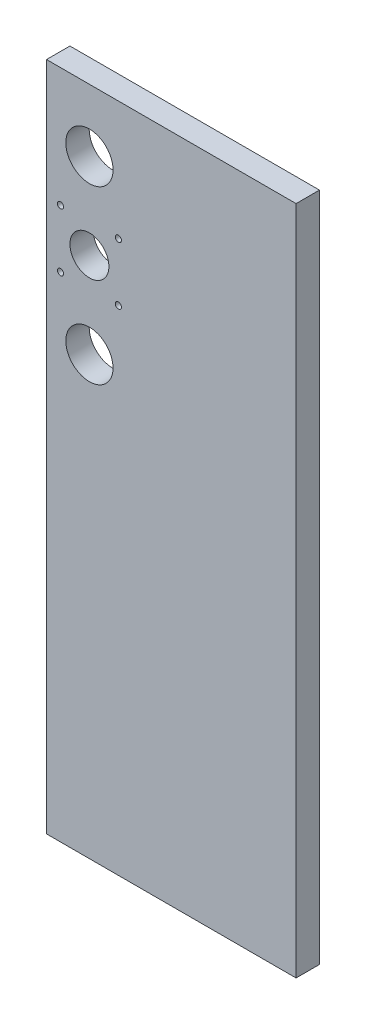
from build123d import *

# Parameters (mm, degrees)
SKETCH1_W               = 203.2
SKETCH1_H               = 546.1
BOSS_EXTRUDE1_DEPTH     = 19.05
SKETCH2_R               = 19.2405
CUT_EXTRUDE1_DEPTH      = 583.990868282
ENL_V_MAT_EXTRU_1_REACH = 584.991
ESQUISSE1_R             = 15.875
ESQUISSE1_R_2           = 2.5


with BuildPart() as part:
    # Sketch1 → Boss-Extrude1 (new body)
    with BuildSketch(Plane.XY):
        with Locations((101.6, 273.05)):
            Rectangle(SKETCH1_W, SKETCH1_H)
    extrude(amount=BOSS_EXTRUDE1_DEPTH)

    # Sketch2 → Cut-Extrude1 (cut, through all)
    with BuildSketch(Plane(origin=(0, 0, 0), x_dir=(-1, 0, 0), z_dir=(0, 0, -1))):
        with Locations((-34.925, 495.3)):
            Circle(SKETCH2_R)
        with Locations((-34.925, 355.6)):
            Circle(SKETCH2_R)
    extrude(amount=-CUT_EXTRUDE1_DEPTH, mode=Mode.SUBTRACT)

    # Esquisse1 → Enlèv. mat.-Extru.1 (cut, up to next)
    with BuildSketch(Plane(origin=(0, 0, 0), x_dir=(-1, 0, 0), z_dir=(0, 0, -1)), mode=Mode.PRIVATE) as enl_v_mat_extru_1_sk1:
        with Locations((-34.925, 425.45)):
            Circle(ESQUISSE1_R)
    enl_v_mat_extru_1_tool1 = extrude(enl_v_mat_extru_1_sk1.sketch, amount=-ENL_V_MAT_EXTRU_1_REACH, mode=Mode.PRIVATE) & part.part
    # Esquisse1 → Enlèv. mat.-Extru.1 (cut, up to next)
    with BuildSketch(Plane(origin=(0, 0, 0), x_dir=(-1, 0, 0), z_dir=(0, 0, -1)), mode=Mode.PRIVATE) as enl_v_mat_extru_1_sk2:
        with Locations((-58.4962, 449.0212)):
            Circle(ESQUISSE1_R_2)
    enl_v_mat_extru_1_tool2 = extrude(enl_v_mat_extru_1_sk2.sketch, amount=-ENL_V_MAT_EXTRU_1_REACH, mode=Mode.PRIVATE) & part.part
    # Esquisse1 → Enlèv. mat.-Extru.1 (cut, up to next)
    with BuildSketch(Plane(origin=(0, 0, 0), x_dir=(-1, 0, 0), z_dir=(0, 0, -1)), mode=Mode.PRIVATE) as enl_v_mat_extru_1_sk3:
        with Locations((-11.3538, 449.0212)):
            Circle(ESQUISSE1_R_2)
    enl_v_mat_extru_1_tool3 = extrude(enl_v_mat_extru_1_sk3.sketch, amount=-ENL_V_MAT_EXTRU_1_REACH, mode=Mode.PRIVATE) & part.part
    # Esquisse1 → Enlèv. mat.-Extru.1 (cut, up to next)
    with BuildSketch(Plane(origin=(0, 0, 0), x_dir=(-1, 0, 0), z_dir=(0, 0, -1)), mode=Mode.PRIVATE) as enl_v_mat_extru_1_sk4:
        with Locations((-11.3538, 401.8788)):
            Circle(ESQUISSE1_R_2)
    enl_v_mat_extru_1_tool4 = extrude(enl_v_mat_extru_1_sk4.sketch, amount=-ENL_V_MAT_EXTRU_1_REACH, mode=Mode.PRIVATE) & part.part
    # Esquisse1 → Enlèv. mat.-Extru.1 (cut, up to next)
    with BuildSketch(Plane(origin=(0, 0, 0), x_dir=(-1, 0, 0), z_dir=(0, 0, -1)), mode=Mode.PRIVATE) as enl_v_mat_extru_1_sk5:
        with Locations((-58.4962, 401.8788)):
            Circle(ESQUISSE1_R_2)
    enl_v_mat_extru_1_tool5 = extrude(enl_v_mat_extru_1_sk5.sketch, amount=-ENL_V_MAT_EXTRU_1_REACH, mode=Mode.PRIVATE) & part.part
    add(enl_v_mat_extru_1_tool1.solids().sort_by_distance((34.925, 425.45, 0))[0], mode=Mode.SUBTRACT)
    add(enl_v_mat_extru_1_tool2.solids().sort_by_distance((58.4962, 449.0212, 0))[0], mode=Mode.SUBTRACT)
    add(enl_v_mat_extru_1_tool3.solids().sort_by_distance((11.3538, 449.0212, 0))[0], mode=Mode.SUBTRACT)
    add(enl_v_mat_extru_1_tool4.solids().sort_by_distance((11.3538, 401.8788, 0))[0], mode=Mode.SUBTRACT)
    add(enl_v_mat_extru_1_tool5.solids().sort_by_distance((58.4962, 401.8788, 0))[0], mode=Mode.SUBTRACT)


solid = part.part
